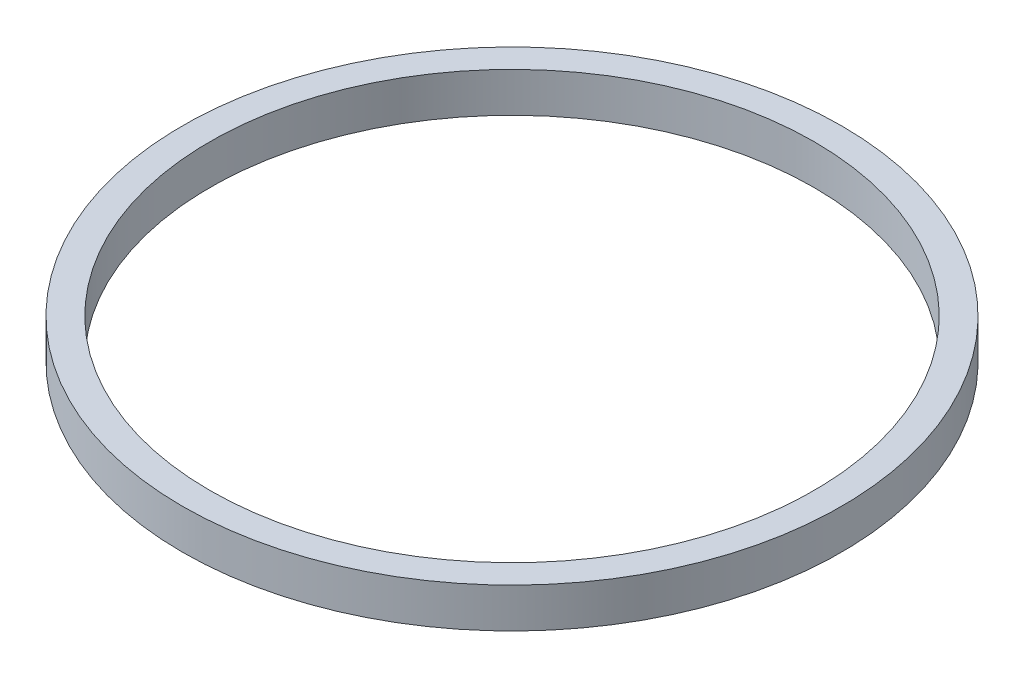
from build123d import *

# Parameters (mm, degrees)
SKETCH1_R           = 30
BOSS_EXTRUDE1_DEPTH = 3.62
SKETCH3_R           = 27.5
CUT_EXTRUDE1_DEPTH  = 3.62


with BuildPart() as part:
    # Sketch1 → Boss-Extrude1 (new body)
    with BuildSketch(Plane(origin=(0, 0, 0), x_dir=(1, 0, 0), z_dir=(0, 1, 0))):
        with Locations(Location((0, 0, 0), (0, 0, 270))):
            Circle(SKETCH1_R)
    extrude(amount=BOSS_EXTRUDE1_DEPTH)

    # Sketch3 → Cut-Extrude1 (cut)
    with BuildSketch(Plane(origin=(0, 3.62, 0), x_dir=(1, 0, 0), z_dir=(0, 1, 0))):
        with Locations(Location((0, 0, 0), (0, 0, 270))):
            Circle(SKETCH3_R)
    extrude(amount=-CUT_EXTRUDE1_DEPTH, mode=Mode.SUBTRACT)


solid = part.part
